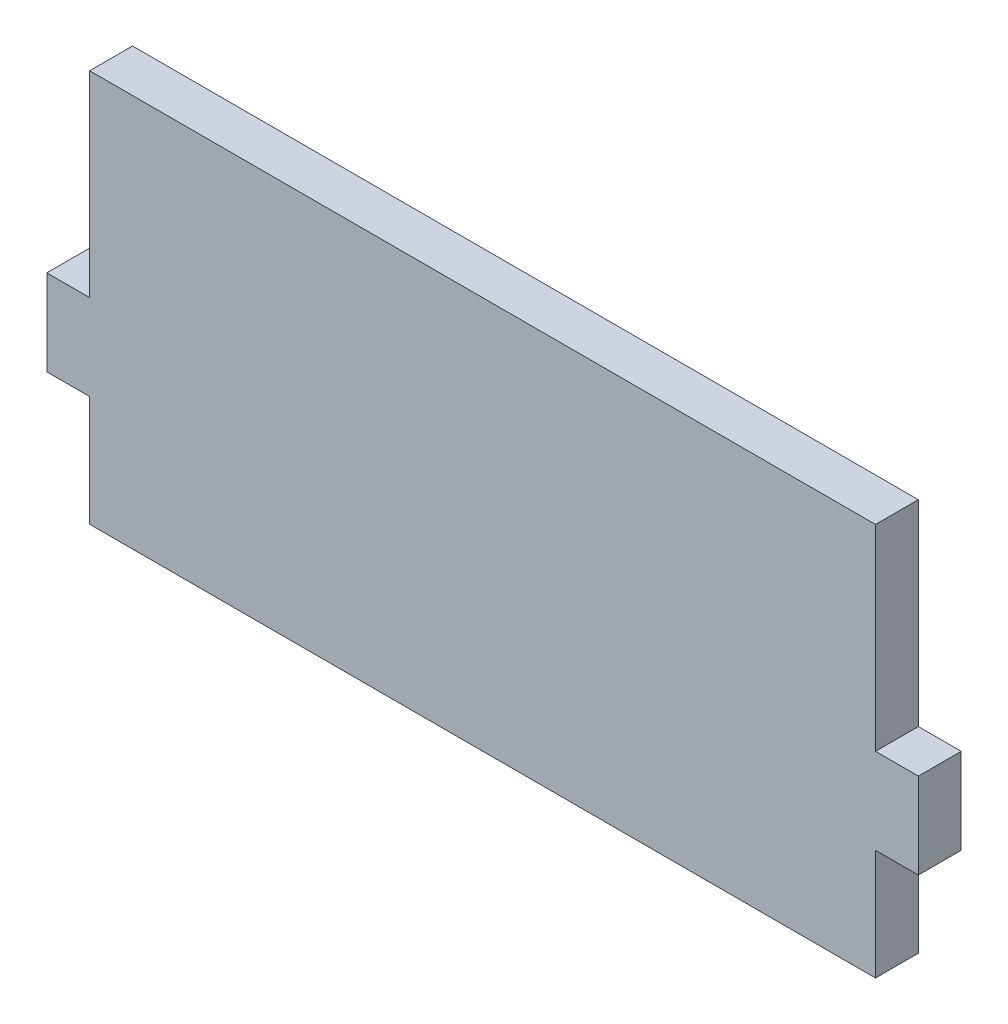
from build123d import *

# Parameters (mm, degrees)
P_IDAT_VYSUNUT_M1_DEPTH = 3


with BuildPart() as part:
    # Skica1 → Přidat vysunutím1 (new body)
    with BuildSketch(Plane.XY):
        Polygon((55, -19.75), (55, -27.49), (0, -27.49), (0, -19.75), (-3, -19.75), (-3, -13.75), (0, -13.75), (0, 0), (55, 0), (55, -13.75), (58, -13.75), (58, -19.75), align=None)
    extrude(amount=P_IDAT_VYSUNUT_M1_DEPTH)


solid = part.part
